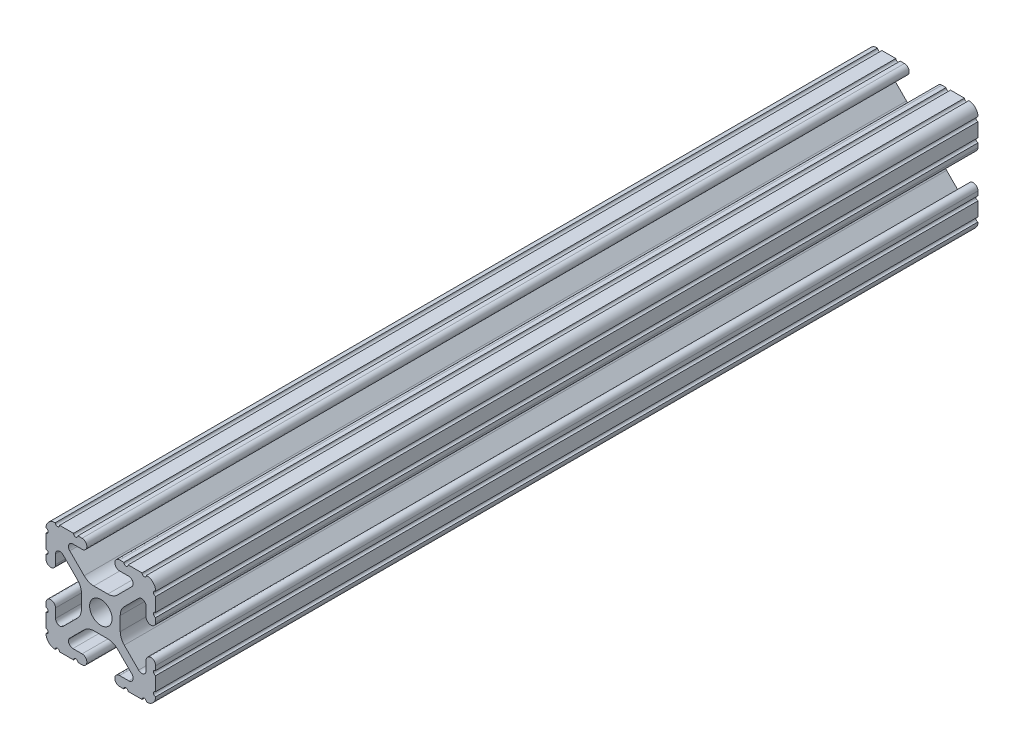
from build123d import *

# Parameters (mm, degrees)
SKETCH1_R           = 2.6035
BOSS_EXTRUDE1_DEPTH = 190.5


with BuildPart() as part:
    # Sketch1 → Boss-Extrude1 (new body)
    with BuildSketch(Plane(origin=(0, 0, -25.4), x_dir=(-1, 0, 0), z_dir=(0, 0, -1))):
        with BuildLine():
            Line((12.7, -9.5504), (12.7, -6.3330836))
            ThreePointArc((12.7, -6.3330836), (12.192, -5.8250836), (12.7, -5.3170836))
            Line((12.7, -5.3170836), (12.7, -4.3434))
            ThreePointArc((12.7, -4.3434), (11.5951, -3.2385), (10.4902, -4.3434))
            Line((10.4902, -4.3434), (10.4902, -6.474794456))
            ThreePointArc((10.4902, -6.474794456), (9.863006367, -7.413456061), (8.75577951, -7.193214945))
            Line((8.75577951, -7.193214945), (5.42573597, -3.863171405))
            ThreePointArc((5.42573597, -3.863171405), (4.737482484, -2.833127272), (4.4958, -1.618107374))
            Line((4.4958, -1.618107374), (4.4958, 1.618107374))
            ThreePointArc((4.4958, 1.618107374), (4.737482484, 2.833127272), (5.42573597, 3.863171405))
            Line((5.42573597, 3.863171405), (8.75577951, 7.193214945))
            ThreePointArc((8.75577951, 7.193214945), (9.863006367, 7.413456061), (10.4902, 6.474794456))
            Line((10.4902, 6.474794456), (10.4902, 4.343399971))
            ThreePointArc((10.4902, 4.343399971), (11.5951, 3.238499971), (12.7, 4.343399971))
            Line((12.7, 4.343399971), (12.7, 5.3170836))
            ThreePointArc((12.7, 5.3170836), (12.192, 5.8250836), (12.7, 6.3330836))
            Line((12.7, 6.3330836), (12.7, 9.5504))
            ThreePointArc((12.7, 9.5504), (12.192000006, 10.058323491), (12.699846982, 10.566399977))
            ThreePointArc((12.699846982, 10.566399977), (12.082522516, 12.082522516), (10.566399977, 12.699846982))
            ThreePointArc((10.566399977, 12.699846982), (10.058323491, 12.192000006), (9.5504, 12.7))
            Line((9.5504, 12.7), (6.3330836, 12.7))
            ThreePointArc((6.3330836, 12.7), (5.8250836, 12.192), (5.3170836, 12.7))
            Line((5.3170836, 12.7), (4.3434, 12.7))
            ThreePointArc((4.3434, 12.7), (3.2385, 11.5951), (4.3434, 10.4902))
            Line((4.3434, 10.4902), (6.474794456, 10.4902))
            ThreePointArc((6.474794456, 10.4902), (7.413456061, 9.863006367), (7.193214945, 8.75577951))
            Line((7.193214945, 8.75577951), (3.863171405, 5.42573597))
            ThreePointArc((3.863171405, 5.42573597), (2.833127272, 4.737482484), (1.618107374, 4.4958))
            Line((1.618107374, 4.4958), (-1.618107374, 4.4958))
            ThreePointArc((-1.618107374, 4.4958), (-2.833127272, 4.737482484), (-3.863171405, 5.42573597))
            Line((-3.863171405, 5.42573597), (-7.193214945, 8.75577951))
            ThreePointArc((-7.193214945, 8.75577951), (-7.413456061, 9.863006367), (-6.474794456, 10.4902))
            Line((-6.474794456, 10.4902), (-4.343399971, 10.4902))
            ThreePointArc((-4.343399971, 10.4902), (-3.238499971, 11.5951), (-4.343399971, 12.7))
            Line((-4.343399971, 12.7), (-5.3170836, 12.7))
            ThreePointArc((-5.3170836, 12.7), (-5.8250836, 12.192), (-6.3330836, 12.7))
            Line((-6.3330836, 12.7), (-9.5504, 12.7))
            ThreePointArc((-9.5504, 12.7), (-10.058323491, 12.192000006), (-10.566399977, 12.699846982))
            ThreePointArc((-10.566399977, 12.699846982), (-12.082522516, 12.082522516), (-12.699846982, 10.566399977))
            ThreePointArc((-12.699846982, 10.566399977), (-12.192000006, 10.058323491), (-12.7, 9.5504))
            Line((-12.7, 9.5504), (-12.7, 6.3330836))
            ThreePointArc((-12.7, 6.3330836), (-12.192, 5.8250836), (-12.7, 5.3170836))
            Line((-12.7, 5.3170836), (-12.7, 4.3434))
            ThreePointArc((-12.7, 4.3434), (-11.5951, 3.2385), (-10.4902, 4.3434))
            Line((-10.4902, 4.3434), (-10.4902, 6.474794456))
            ThreePointArc((-10.4902, 6.474794456), (-9.863006367, 7.413456061), (-8.75577951, 7.193214945))
            Line((-8.75577951, 7.193214945), (-5.42573597, 3.863171405))
            ThreePointArc((-5.42573597, 3.863171405), (-4.737482484, 2.833127272), (-4.4958, 1.618107374))
            Line((-4.4958, 1.618107374), (-4.4958, -1.618107374))
            ThreePointArc((-4.4958, -1.618107374), (-4.737482484, -2.833127272), (-5.42573597, -3.863171405))
            Line((-5.42573597, -3.863171405), (-8.75577951, -7.193214945))
            ThreePointArc((-8.75577951, -7.193214945), (-9.863006367, -7.413456061), (-10.4902, -6.474794456))
            Line((-10.4902, -6.474794456), (-10.4902, -4.343399971))
            ThreePointArc((-10.4902, -4.343399971), (-11.5951, -3.238499971), (-12.7, -4.343399971))
            Line((-12.7, -4.343399971), (-12.7, -5.3170836))
            ThreePointArc((-12.7, -5.3170836), (-12.192, -5.8250836), (-12.7, -6.3330836))
            Line((-12.7, -6.3330836), (-12.7, -9.5504))
            ThreePointArc((-12.7, -9.5504), (-12.192000006, -10.058323491), (-12.699846982, -10.566399977))
            ThreePointArc((-12.699846982, -10.566399977), (-12.082522516, -12.082522516), (-10.566399977, -12.699846982))
            ThreePointArc((-10.566399977, -12.699846982), (-10.058323491, -12.192000006), (-9.5504, -12.7))
            Line((-9.5504, -12.7), (-6.3330836, -12.7))
            ThreePointArc((-6.3330836, -12.7), (-5.8250836, -12.192), (-5.3170836, -12.7))
            Line((-5.3170836, -12.7), (-4.3434, -12.7))
            ThreePointArc((-4.3434, -12.7), (-3.2385, -11.5951), (-4.3434, -10.4902))
            Line((-4.3434, -10.4902), (-6.474794456, -10.4902))
            ThreePointArc((-6.474794456, -10.4902), (-7.413456061, -9.863006367), (-7.193214945, -8.75577951))
            Line((-7.193214945, -8.75577951), (-3.863171405, -5.42573597))
            ThreePointArc((-3.863171405, -5.42573597), (-2.833127272, -4.737482484), (-1.618107374, -4.4958))
            Line((-1.618107374, -4.4958), (1.618107374, -4.4958))
            ThreePointArc((1.618107374, -4.4958), (2.833127272, -4.737482484), (3.863171405, -5.42573597))
            Line((3.863171405, -5.42573597), (7.193214945, -8.75577951))
            ThreePointArc((7.193214945, -8.75577951), (7.413456061, -9.863006367), (6.474794456, -10.4902))
            Line((6.474794456, -10.4902), (4.343399971, -10.4902))
            ThreePointArc((4.343399971, -10.4902), (3.238499971, -11.5951), (4.343399971, -12.7))
            Line((4.343399971, -12.7), (5.3170836, -12.7))
            ThreePointArc((5.3170836, -12.7), (5.8250836, -12.192), (6.3330836, -12.7))
            Line((6.3330836, -12.7), (9.5504, -12.7))
            ThreePointArc((9.5504, -12.7), (10.058323491, -12.192000006), (10.566399977, -12.699846982))
            ThreePointArc((10.566399977, -12.699846982), (12.082522516, -12.082522516), (12.699846982, -10.566399977))
            ThreePointArc((12.699846982, -10.566399977), (12.192000006, -10.058323491), (12.7, -9.5504))
        make_face()
        with Locations(Location((0, 0, 0), (0, 0, 180))):
            Circle(SKETCH1_R, mode=Mode.SUBTRACT)
    extrude(amount=-BOSS_EXTRUDE1_DEPTH)


solid = part.part
